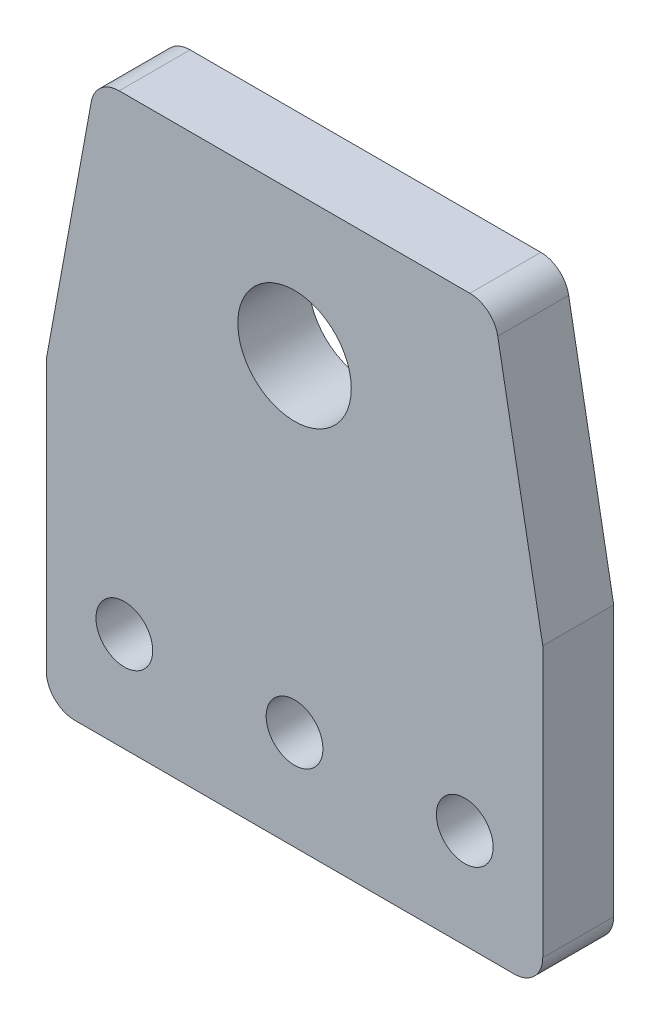
from build123d import *

# Parameters (mm, degrees)
SKETCH_1_R      = 4
SKETCH_1_R_2    = 2
EXTRUDE_1_DEPTH = 5


with BuildPart() as part:
    # 草图1 → 凸台-拉伸1 (new body)
    with BuildSketch(Plane.XY):
        with BuildLine():
            Line((2, 0), (33, 0))
            ThreePointArc((33, 0), (34.414213562, 0.585786438), (35, 2))
            Line((35, 2), (35, 21.050341825))
            Line((35, 21.050341825), (31.828098105, 38.360477291))
            ThreePointArc((31.828098105, 38.360477291), (31.141290767, 39.536384487), (29.860852284, 40))
            Line((29.860852284, 40), (5.139147716, 40))
            ThreePointArc((5.139147716, 40), (3.858709233, 39.536384487), (3.171901895, 38.360477291))
            Line((3.171901895, 38.360477291), (0, 21.050341825))
            Line((0, 21.050341825), (0, 2))
            ThreePointArc((0, 2), (0.585786438, 0.585786438), (2, 0))
        make_face()
        with Locations((17.5, 30)):
            Circle(SKETCH_1_R, mode=Mode.SUBTRACT)
        with Locations((17.5, 7)):
            Circle(SKETCH_1_R_2, mode=Mode.SUBTRACT)
        with Locations((29.5, 7)):
            Circle(SKETCH_1_R_2, mode=Mode.SUBTRACT)
        with Locations((5.5, 7)):
            Circle(SKETCH_1_R_2, mode=Mode.SUBTRACT)
    extrude(amount=EXTRUDE_1_DEPTH)


solid = part.part
